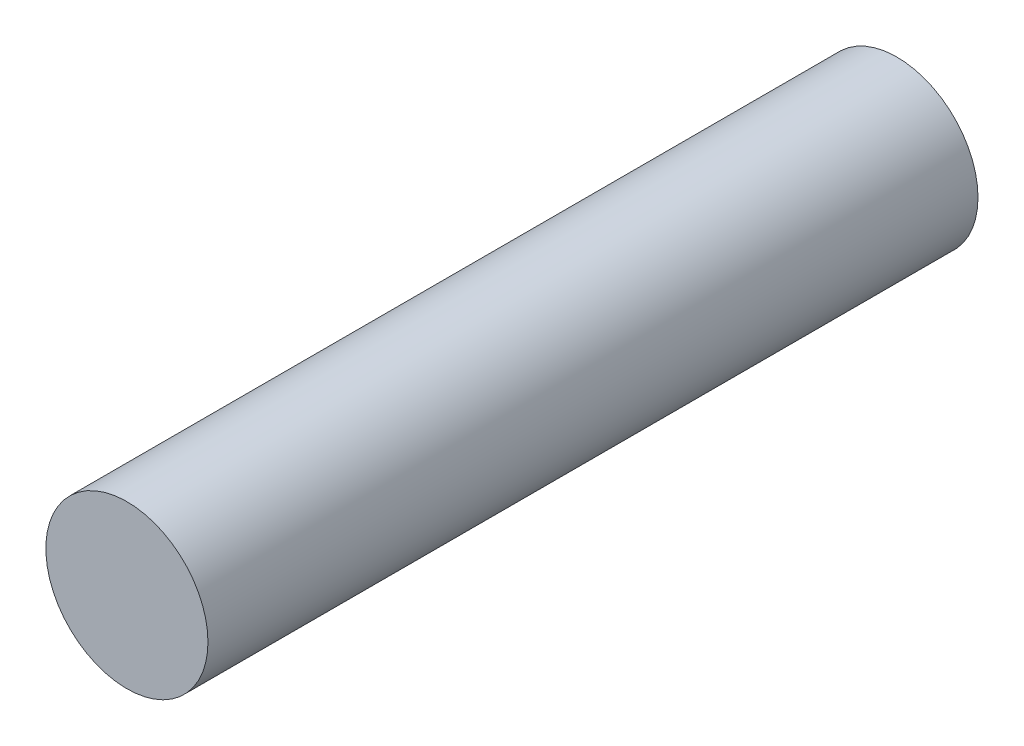
from build123d import *

# Parameters (mm, degrees)
SKETCH1_R           = 10
BOSS_EXTRUDE1_DEPTH = 95


with BuildPart() as part:
    # Sketch1 → Boss-Extrude1 (new body)
    with BuildSketch(Plane.XY):
        Circle(SKETCH1_R)
    extrude(amount=BOSS_EXTRUDE1_DEPTH)


solid = part.part
